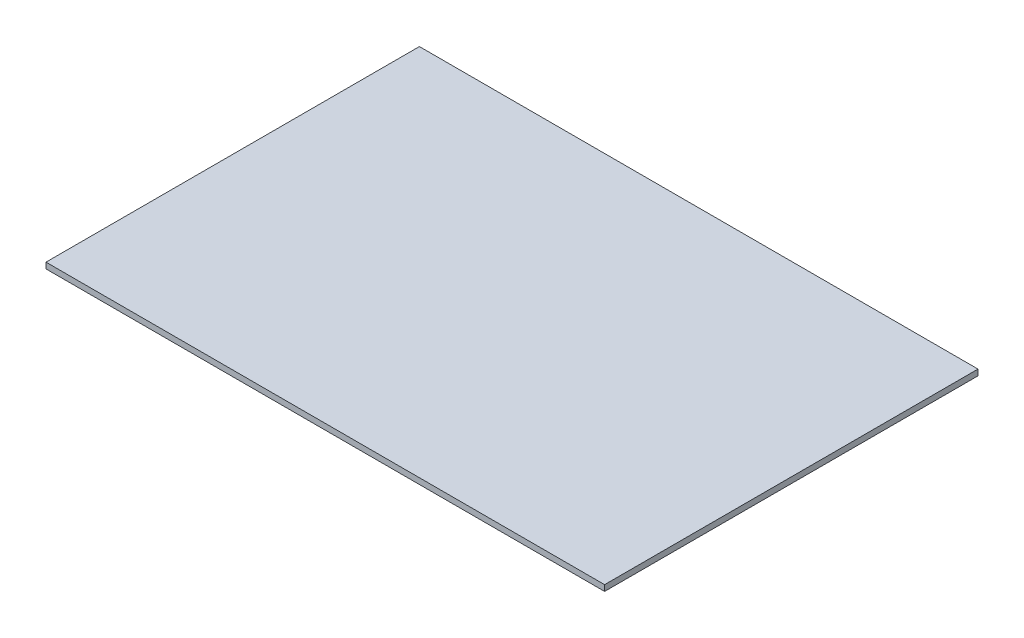
from build123d import *

# Parameters (mm, degrees)
SKETCH_1_W      = 450
SKETCH_1_H      = 300.8
EXTRUDE_1_DEPTH = 4.75


with BuildPart() as part:
    # 草圖1 → 填料-伸長1 (new body)
    with BuildSketch(Plane(origin=(0, 0, 0), x_dir=(1, 0, 0), z_dir=(0, 1, 0))):
        Rectangle(SKETCH_1_W, SKETCH_1_H)
    extrude(amount=EXTRUDE_1_DEPTH)


solid = part.part
